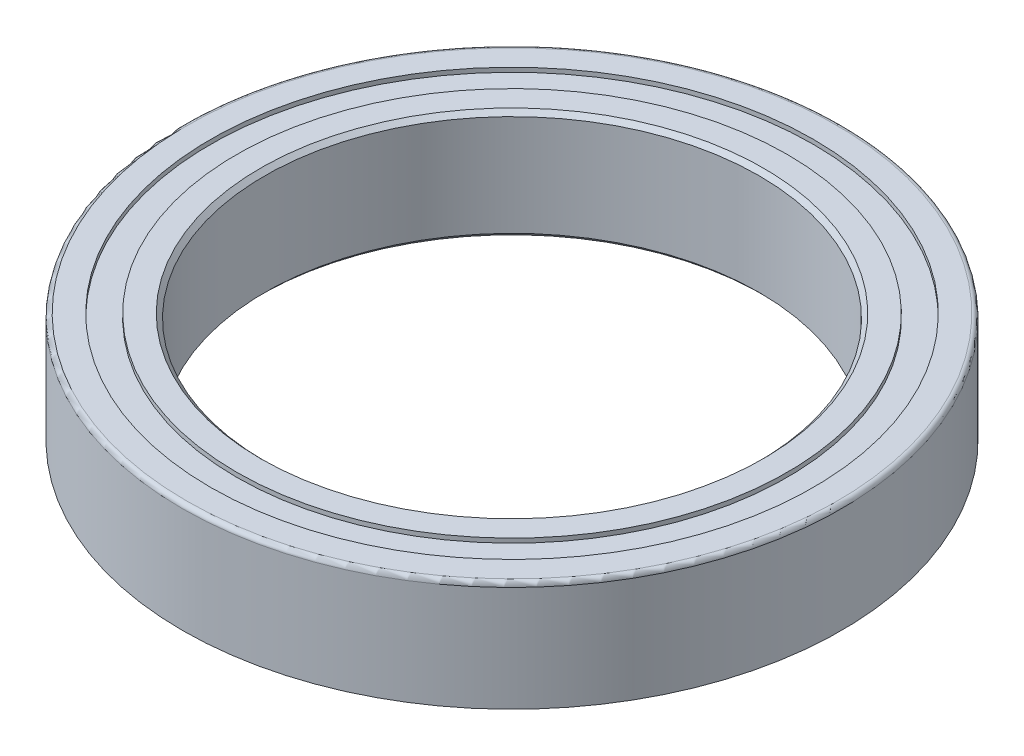
from build123d import *

# Parameters (mm, degrees)
SKETCH1_R             = 9.525
SKETCH1_R_2           = 8.7122
BOSS_EXTRUDE1_DEPTH   = 1.5875
SKETCH1_R_3           = 7.95655
SKETCH1_R_4           = 7.14375
BOSS_EXTRUDE1_2_DEPTH = 1.5875
FILLET1_R             = 0.127
CHAMFER1_SIZE         = 0.127
SKETCH2_R             = 8.7122
SKETCH2_R_2           = 7.95655
BOSS_EXTRUDE2_DEPTH   = 1.4605


with BuildPart() as part:
    # Sketch1 → Boss-Extrude1 (new, symmetric)
    with BuildSketch(Plane(origin=(0, 0, 0), x_dir=(1, 0, 0), z_dir=(0, 1, 0))):
        with Locations(Location((0, 0, 0), (0, 0, 270))):
            Circle(SKETCH1_R)
        with Locations(Location((0, 0, 0), (0, 0, 270))):
            Circle(SKETCH1_R_2, mode=Mode.SUBTRACT)
    extrude(amount=BOSS_EXTRUDE1_DEPTH, both=True)

    # Fillet1
    fillet1_edges = [part.edges().sort_by_distance(p)[0] for p in [
        (0, 1.5875, -9.525),
    ]]
    fillet(fillet1_edges, radius=FILLET1_R)



with BuildPart() as body_2:
    # Sketch1 → Boss-Extrude1 2 (new, symmetric)
    with BuildSketch(Plane(origin=(0, 0, 0), x_dir=(1, 0, 0), z_dir=(0, 1, 0))):
        with Locations(Location((0, 0, 0), (0, 0, 270))):
            Circle(SKETCH1_R_3)
        with Locations(Location((0, 0, 0), (0, 0, 270))):
            Circle(SKETCH1_R_4, mode=Mode.SUBTRACT)
    extrude(amount=BOSS_EXTRUDE1_2_DEPTH, both=True)

    # Chamfer1
    chamfer1_edges = [body_2.edges().sort_by_distance(p)[0] for p in [
        (0, -1.5875, -7.14375),
        (0, 1.5875, -7.14375),
    ]]
    chamfer(chamfer1_edges, length=CHAMFER1_SIZE)


with BuildPart() as part_1:
    add(part.part)

    add(body_2.part)  # Boss-Extrude2 merges body 2
    # Sketch2 → Boss-Extrude2 (add, symmetric)
    with BuildSketch(Plane(origin=(0, 0, 0), x_dir=(1, 0, 0), z_dir=(0, 1, 0))):
        with Locations(Location((0, 0, 0), (0, 0, 270))):
            Circle(SKETCH2_R)
        with Locations(Location((0, 0, 0), (0, 0, 270))):
            Circle(SKETCH2_R_2, mode=Mode.SUBTRACT)
    extrude(amount=BOSS_EXTRUDE2_DEPTH, both=True)


solid = part_1.part
